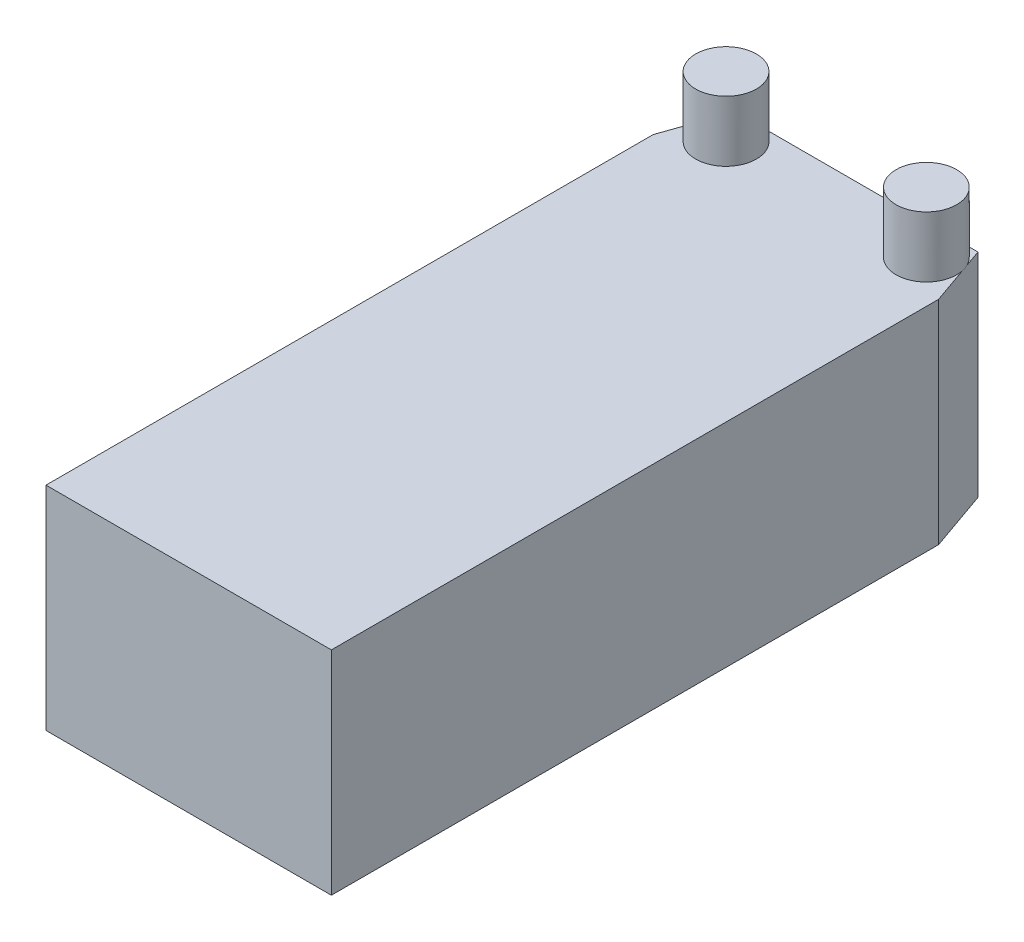
from build123d import *

# Parameters (mm, degrees)
EXTRUDE_1_DEPTH = 35
SKETCH_2_R      = 5
EXTRUDE_2_DEPTH = 10


with BuildPart() as part:
    # 草图1 → 凸台-拉伸1 (new body)
    with BuildSketch(Plane(origin=(0, 0, 0), x_dir=(1, 0, 0), z_dir=(0, 1, 0))):
        Polygon((-23.5, 50), (-20, 60), (20, 60), (23.5, 50), (23.5, -50), (-23.5, -50), align=None)
    extrude(amount=EXTRUDE_1_DEPTH)

    # 草图2 → 凸台-拉伸2 (add)
    with BuildSketch(Plane(origin=(0, 35, 0), x_dir=(1, 0, 0), z_dir=(0, 1, 0))):
        with Locations(Location((-16.5, 55, 0), (0, 0, 90))):
            Circle(SKETCH_2_R)
        with Locations(Location((16.5, 55, 0), (0, 0, 90))):
            Circle(SKETCH_2_R)
    extrude(amount=EXTRUDE_2_DEPTH)


solid = part.part
